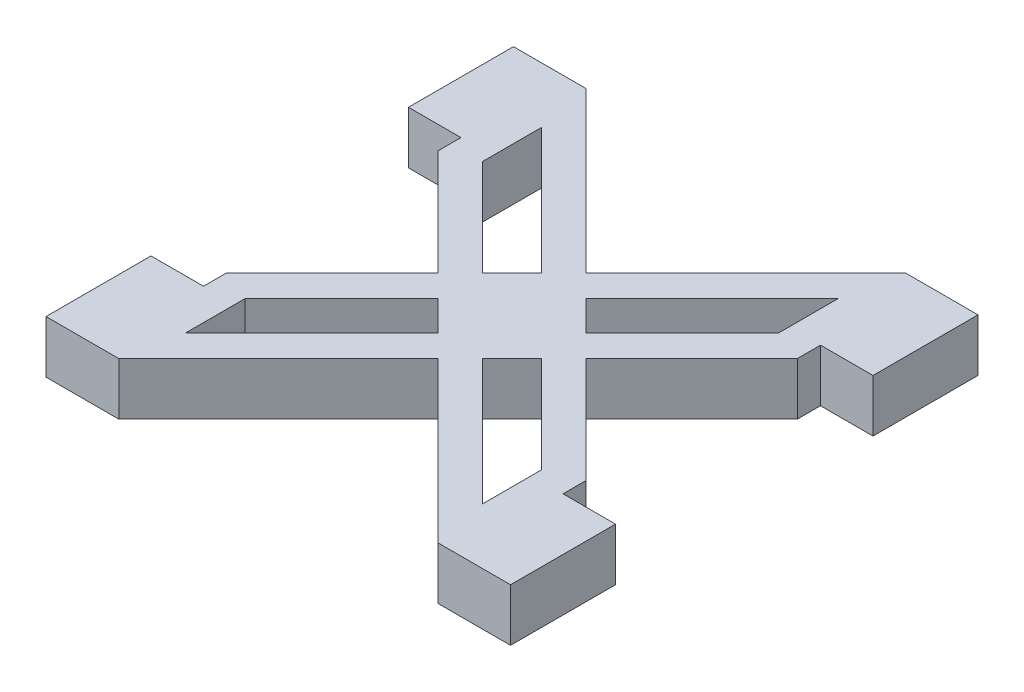
from build123d import *

# Parameters (mm, degrees)
BOSS_EXTRUDE1_DEPTH = 6.35


with BuildPart() as part:
    # Sketch1 → Boss-Extrude1 (new body)
    with BuildSketch(Plane(origin=(0, 0, 0), x_dir=(1, 0, 0), z_dir=(0, 1, 0))):
        Polygon((-28.0924, 15.5702), (-28.0924, 28.2702), (-19.289943879, 28.2702), (0, 8.980256121), (19.289943879, 28.2702), (28.0924, 28.2702), (28.0924, 15.5702), (21.7424, 15.5702), (21.7424, 12.762143879), (8.980256121, 0), (21.7424, -12.762143879), (21.7424, -15.5702), (28.0924, -15.5702), (28.0924, -28.2702), (19.289943879, -28.2702), (0, -8.980256121), (-19.289943879, -28.2702), (-28.0924, -28.2702), (-28.0924, -15.5702), (-21.7424, -15.5702), (-21.7424, -12.762143879), (-8.980256121, 0), (-21.7424, 12.762143879), (-21.7424, 15.5702), align=None)
        Polygon((6.286179285, 2.694076836), (2.694076836, 6.286179285), (17.9324, 21.524502448), (17.9324, 14.340297552), align=None, mode=Mode.SUBTRACT)
        Polygon((2.694076836, -6.286179285), (6.286179285, -2.694076836), (17.9324, -14.340297552), (17.9324, -21.524502448), align=None, mode=Mode.SUBTRACT)
        Polygon((-6.286179285, 2.694076836), (-2.694076836, 6.286179285), (-17.9324, 21.524502448), (-17.9324, 14.340297552), align=None, mode=Mode.SUBTRACT)
        Polygon((-6.286179285, -2.694076836), (-2.694076836, -6.286179285), (-17.9324, -21.524502448), (-17.9324, -14.340297552), align=None, mode=Mode.SUBTRACT)
    extrude(amount=BOSS_EXTRUDE1_DEPTH)


solid = part.part
